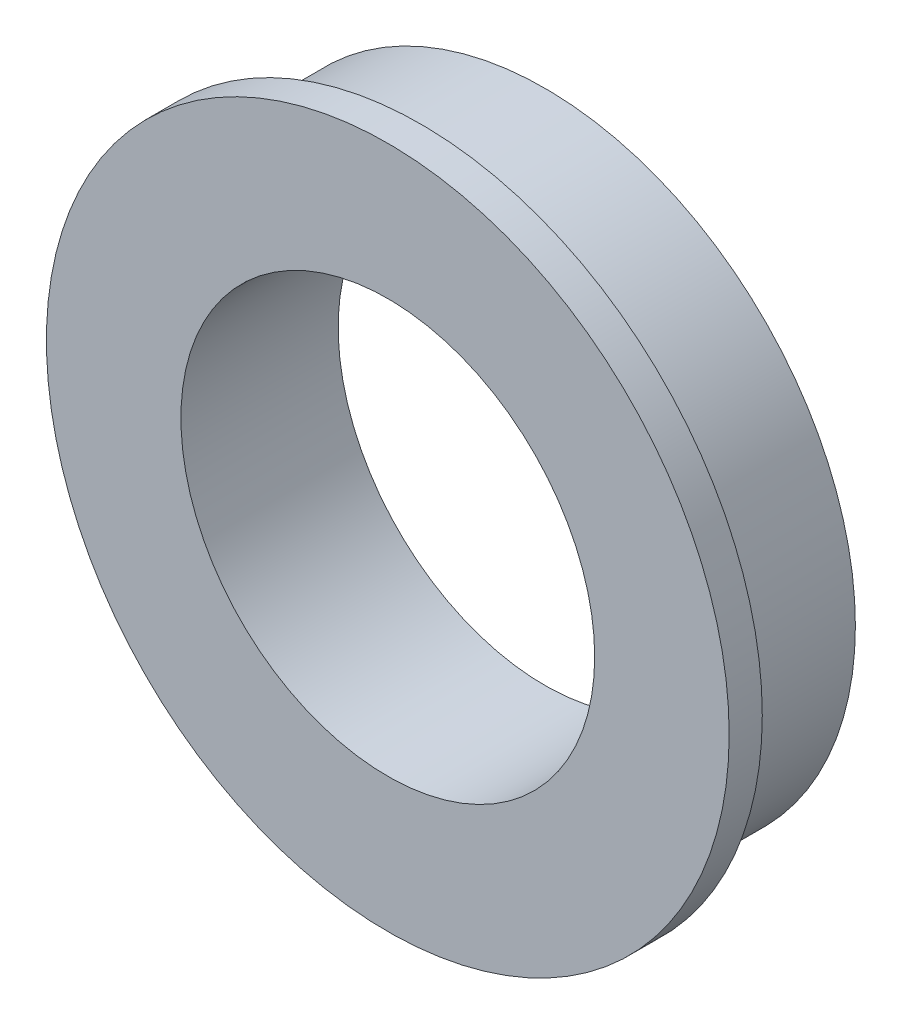
from build123d import *

# Parameters (mm, degrees)
SKETCH1_R           = 7.5
SKETCH1_R_2         = 5
BOSS_EXTRUDE1_DEPTH = 3
SKETCH2_R           = 8.25
SKETCH2_R_2         = 5
BOSS_EXTRUDE2_DEPTH = 0.8


with BuildPart() as part:
    # Sketch1 → Boss-Extrude1 (new body)
    with BuildSketch(Plane.XY):
        Circle(SKETCH1_R)
        Circle(SKETCH1_R_2, mode=Mode.SUBTRACT)
    extrude(amount=BOSS_EXTRUDE1_DEPTH)

    # Sketch2 → Boss-Extrude2 (add)
    with BuildSketch(Plane.XY.offset(3)):
        Circle(SKETCH2_R)
        Circle(SKETCH2_R_2, mode=Mode.SUBTRACT)
    extrude(amount=BOSS_EXTRUDE2_DEPTH)


solid = part.part
